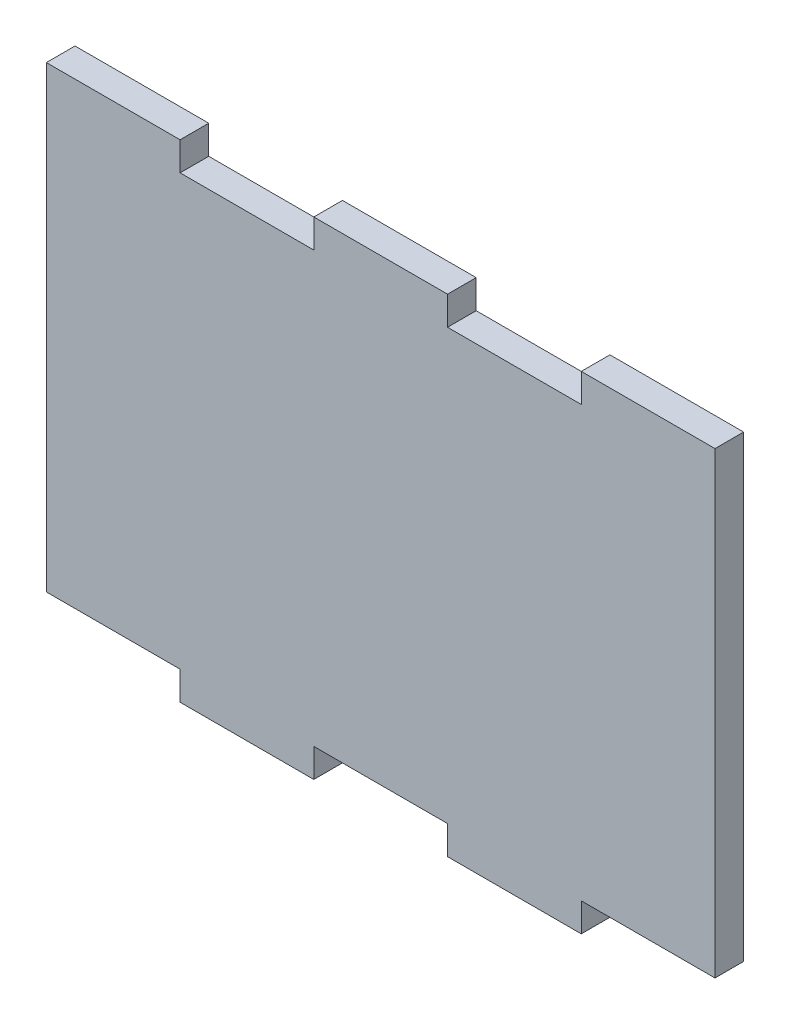
from build123d import *

# Parameters (mm, degrees)
BOSS_EXTRUDE1_DEPTH = 3


with BuildPart() as part:
    # Sketch1 → Boss-Extrude1 (new body)
    with BuildSketch(Plane.XY):
        Polygon((-7, 0), (7, 0), (7, -3), (21, -3), (21, 0), (35, 0), (35, 48), (21, 48), (21, 45), (7, 45), (7, 48), (-7, 48), (-7, 45), (-21, 45), (-21, 48), (-35, 48), (-35, 0), (-21, 0), (-21, -3), (-7, -3), align=None)
    extrude(amount=BOSS_EXTRUDE1_DEPTH)


solid = part.part
